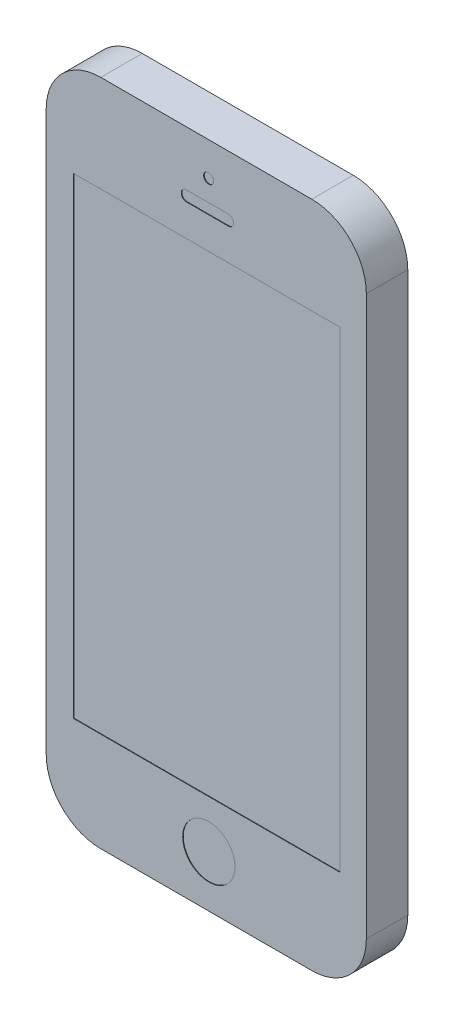
from build123d import *

# Parameters (mm, degrees)
SKETCH1_R             = 4.794993456
SKETCH1_R_2           = 0.915166918
SKETCH1_W             = 48.799909539
SKETCH1_H             = 86.535871975
BOSS_EXTRUDE1_DEPTH   = 7.6
SKETCH3_R             = 0.915166918
BOSS_EXTRUDE2_DEPTH   = 7.5
SKETCH3_R_2           = 4.794993456
BOSS_EXTRUDE2_2_DEPTH = 7.5
BOSS_EXTRUDE2_3_DEPTH = 7.5
SKETCH3_W             = 48.799909539
SKETCH3_H             = 86.535871975
BOSS_EXTRUDE2_4_DEPTH = 7.5


with BuildPart() as part:
    # Sketch1 → Boss-Extrude1 (new body)
    with BuildSketch(Plane.XY):
        with BuildLine():
            Line((10, 122.457841284), (48.679851021, 122.457841284))
            ThreePointArc((48.679851021, 122.457841284), (55.750918833, 119.528909096), (58.679851021, 112.457841284))
            Line((58.679851021, 112.457841284), (58.679851021, 10))
            ThreePointArc((58.679851021, 10), (55.750918833, 2.928932188), (48.679851021, 0))
            Line((48.679851021, 0), (10, 0))
            ThreePointArc((10, 0), (2.928932188, 2.928932188), (0, 10))
            Line((0, 10), (0, 112.457841284))
            ThreePointArc((0, 112.457841284), (2.928932188, 119.528909096), (10, 122.457841284))
        make_face()
        with Locations(Location((29.814429581, 9.416290081, 0), (0, 0, 180))):
            Circle(SKETCH1_R, mode=Mode.SUBTRACT)
        with Locations(Location((29.779654638, 116.314194172, 0), (0, 0, 180))):
            Circle(SKETCH1_R_2, mode=Mode.SUBTRACT)
        with BuildLine():
            Line((25.715880065, 112.44857436), (33.39164387, 112.44857436))
            ThreePointArc((33.39164387, 112.44857436), (34.347883806, 111.492334425), (33.39164387, 110.536094489))
            Line((33.39164387, 110.536094489), (25.715880065, 110.536094489))
            ThreePointArc((25.715880065, 110.536094489), (24.75964013, 111.492334425), (25.715880065, 112.44857436))
        make_face(mode=Mode.SUBTRACT)
        with Locations((29.429003068, 61.44946515)):
            Rectangle(SKETCH1_W, SKETCH1_H, mode=Mode.SUBTRACT)
    extrude(amount=BOSS_EXTRUDE1_DEPTH)


with BuildPart() as body_2:
    # Sketch3 → Boss-Extrude2 (new body)
    with BuildSketch(Plane(origin=(0, 0, 0), x_dir=(-1, 0, 0), z_dir=(0, 0, -1))):
        with Locations((-29.779654638, 116.314194172)):
            Circle(SKETCH3_R)
    extrude(amount=-BOSS_EXTRUDE2_DEPTH)


with BuildPart() as body_3:
    # Sketch3 → Boss-Extrude2 2 (new body)
    with BuildSketch(Plane(origin=(0, 0, 0), x_dir=(-1, 0, 0), z_dir=(0, 0, -1))):
        with Locations((-29.814429581, 9.416290081)):
            Circle(SKETCH3_R_2)
    extrude(amount=-BOSS_EXTRUDE2_2_DEPTH)


with BuildPart() as body_4:
    # Sketch3 → Boss-Extrude2 3 (new body)
    with BuildSketch(Plane(origin=(0, 0, 0), x_dir=(-1, 0, 0), z_dir=(0, 0, -1))):
        with BuildLine():
            Line((-25.715880065, 112.44857436), (-33.39164387, 112.44857436))
            ThreePointArc((-33.39164387, 112.44857436), (-34.347883806, 111.492334425), (-33.39164387, 110.536094489))
            Line((-33.39164387, 110.536094489), (-25.715880065, 110.536094489))
            ThreePointArc((-25.715880065, 110.536094489), (-24.75964013, 111.492334425), (-25.715880065, 112.44857436))
        make_face()
    extrude(amount=-BOSS_EXTRUDE2_3_DEPTH)


with BuildPart() as body_5:
    # Sketch3 → Boss-Extrude2 4 (new body)
    with BuildSketch(Plane(origin=(0, 0, 0), x_dir=(-1, 0, 0), z_dir=(0, 0, -1))):
        with Locations((-29.429003068, 61.44946515)):
            Rectangle(SKETCH3_W, SKETCH3_H)
    extrude(amount=-BOSS_EXTRUDE2_4_DEPTH)


solid = Compound([part.part, body_2.part, body_3.part, body_4.part, body_5.part])
